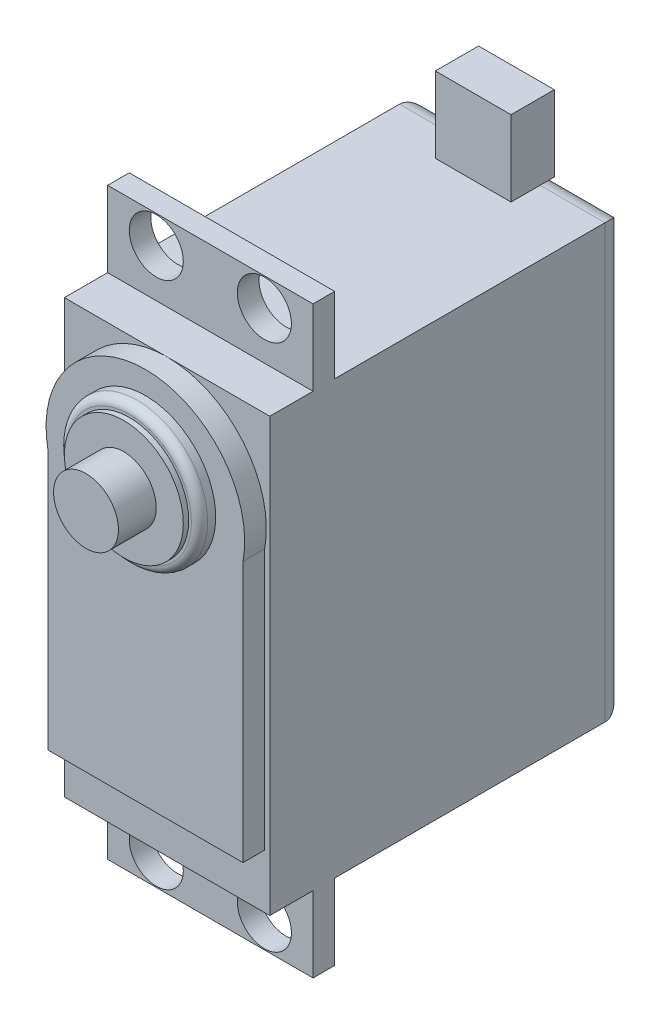
from build123d import *

# Parameters (mm, degrees)
BOSS_EXTRU_1_DEPTH       = 9.5
ESQUISSE3_R              = 2.5
ENL_V_MAT_EXTRU_40_DEPTH = 10
BOSS_EXTRU_2_DEPTH       = 2
CONG_1_R                 = 2
ESQUISSE5_R              = 6.5
BOSS_EXTRU_3_DEPTH       = 1.5
CONG_2_R                 = 0.75
ESQUISSE6_R              = 5.5
BOSS_EXTRU_4_DEPTH       = 0.5
ESQUISSE7_R              = 3
BOSS_EXTRU_5_DEPTH       = 3.5
ESQUISSE8_W              = 7
ESQUISSE8_H              = 4
BOSS_EXTRU_6_DEPTH       = 7


with BuildPart() as part:
    # Esquisse1 → Boss.-Extru.1 (new, symmetric)
    with BuildSketch(Plane(origin=(0, 0, 0), x_dir=(0, 0, -1), z_dir=(1, 0, 0))):
        Polygon((0, 0), (4, 0), (4, -7), (6, -7), (6, 0), (33, 0), (33, 40), (6, 40), (6, 47), (4, 47), (4, 40), (0, 40), align=None)
    extrude(amount=BOSS_EXTRU_1_DEPTH, both=True)

    # Esquisse3 → Enlèv. mat.-Extru.40 (cut)
    with BuildSketch(Plane.XY.offset(-4)):
        with Locations((5, 44.4)):
            Circle(ESQUISSE3_R)
        with Locations((-5, 44.4)):
            Circle(ESQUISSE3_R)
        with Locations((5, -4.4)):
            Circle(ESQUISSE3_R)
        with Locations((-5, -4.4)):
            Circle(ESQUISSE3_R)
    extrude(amount=-ENL_V_MAT_EXTRU_40_DEPTH, mode=Mode.SUBTRACT)

    # Esquisse4 → Boss.-Extru.2 (add)
    with BuildSketch(Plane.XY):
        with BuildLine():
            Line((-9.034932354, 5), (9.018945802, 5))
            Line((9.018945802, 5), (9.018945802, 29.110938176))
            ThreePointArc((9.018945802, 29.110938176), (-0.007993276, 40), (-9.034932354, 29.110938176))
            Line((-9.034932354, 29.110938176), (-9.034932354, 5))
        make_face()
    extrude(amount=BOSS_EXTRU_2_DEPTH)

    # Congé1
    cong_1_edges = [part.edges().sort_by_distance(p)[0] for p in [
        (-9.5, 20, -33),
        (0, 40, -33),
        (0, 0, -33),
        (9.5, 20, -33),
    ]]
    fillet(cong_1_edges, radius=CONG_1_R)

    # Esquisse5 → Boss.-Extru.3 (add)
    with BuildSketch(Plane.XY.offset(2)):
        with Locations(Location((0, 31.4090745, 0), (0, 0, 180))):
            Circle(ESQUISSE5_R)
    extrude(amount=BOSS_EXTRU_3_DEPTH)

    # Congé2
    cong_2_edges = [part.edges().sort_by_distance(p)[0] for p in [
        (6.5, 31.4090745, 3.5),
    ]]
    fillet(cong_2_edges, radius=CONG_2_R)

    # Esquisse6 → Boss.-Extru.4 (add)
    with BuildSketch(Plane.XY.offset(3.5)):
        with Locations((0, 31.4090745)):
            Circle(ESQUISSE6_R)
    extrude(amount=BOSS_EXTRU_4_DEPTH)

    # Esquisse7 → Boss.-Extru.5 (add)
    with BuildSketch(Plane.XY.offset(4)):
        with Locations((0, 31.4090745)):
            Circle(ESQUISSE7_R)
    extrude(amount=BOSS_EXTRU_5_DEPTH)

    # Esquisse8 → Boss.-Extru.6 (add)
    with BuildSketch(Plane(origin=(0, 40, 0), x_dir=(1, 0, 0), z_dir=(0, 1, 0))):
        with Locations((0, 30.314213562)):
            Rectangle(ESQUISSE8_W, ESQUISSE8_H)
    extrude(amount=BOSS_EXTRU_6_DEPTH)


solid = part.part
